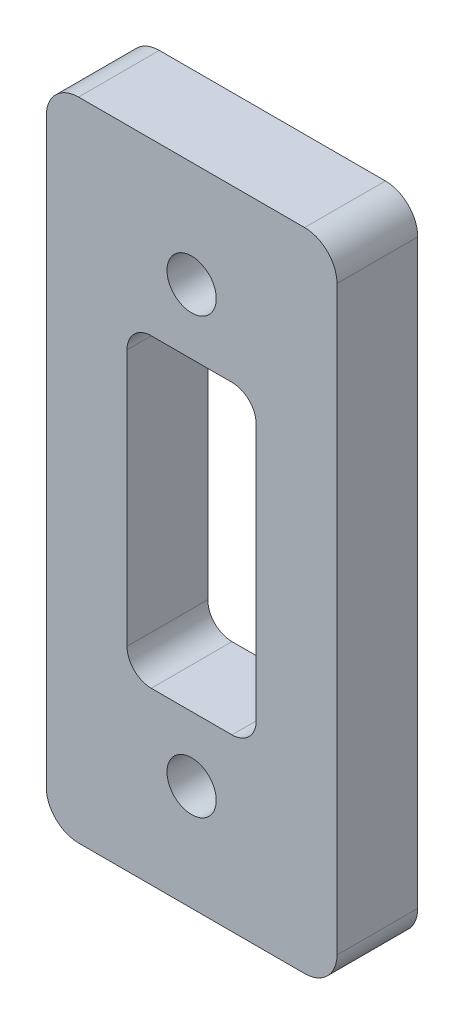
from build123d import *

# Parameters (mm, degrees)
SKETCH_1_W          = 18
SKETCH_1_H          = 40
SKETCH_1_R          = 1.525
EXTRUDE_1_DEPTH     = 5
FILLET_1_R          = 2
SKETCH_2_W          = 8
SKETCH_2_H          = 18.9
CUT_EXTRUDE_1_DEPTH = 5
FILLET_2_R          = 1.5


with BuildPart() as part:
    # 草图1 → 凸台-拉伸1 (new body)
    with BuildSketch(Plane.XY):
        Rectangle(SKETCH_1_W, SKETCH_1_H)
        with Locations((0, 13.45)):
            Circle(SKETCH_1_R, mode=Mode.SUBTRACT)
        with Locations((0, -13.45)):
            Circle(SKETCH_1_R, mode=Mode.SUBTRACT)
    extrude(amount=EXTRUDE_1_DEPTH)

    # 圆角1
    fillet_1_edges = [part.edges().sort_by_distance(p)[0] for p in [
        (9, -20, 2.5),
        (-9, -20, 2.5),
        (-9, 20, 2.5),
        (9, 20, 2.5),
    ]]
    fillet(fillet_1_edges, radius=FILLET_1_R)

    # 草图2 → 切除-拉伸1 (cut)
    with BuildSketch(Plane.XY.offset(5)):
        Rectangle(SKETCH_2_W, SKETCH_2_H)
    extrude(amount=-CUT_EXTRUDE_1_DEPTH, mode=Mode.SUBTRACT)

    # 圆角2
    fillet_2_edges = [part.edges().sort_by_distance(p)[0] for p in [
        (4, 9.45, 2.5),
        (4, -9.45, 2.5),
        (-4, -9.45, 2.5),
        (-4, 9.45, 2.5),
    ]]
    fillet(fillet_2_edges, radius=FILLET_2_R)


solid = part.part
